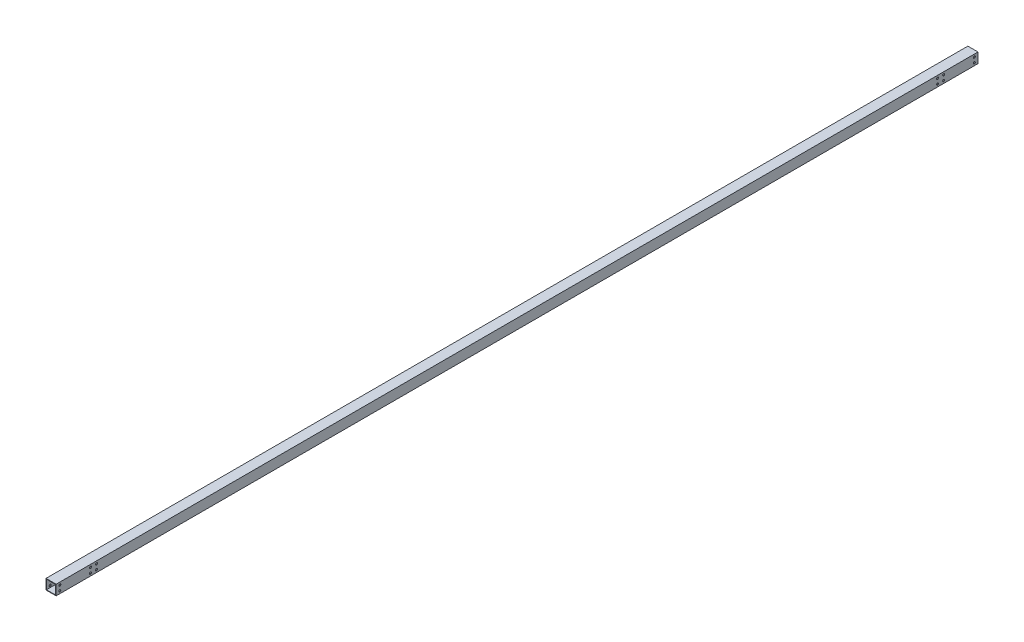
from build123d import *

# Parameters (mm, degrees)
SKETCH_1_W          = 20
SKETCH_1_H          = 20
SKETCH_1_W_2        = 18
SKETCH_1_H_2        = 18
EXTRUDE_1_DEPTH     = 1820
SKETCH_2_R          = 2
CUT_EXTRUDE_1_DEPTH = 1821.219766951


with BuildPart() as part:
    # 草图1 → 凸台-拉伸1 (new body)
    with BuildSketch(Plane.XY):
        with Locations((10, 10)):
            Rectangle(SKETCH_1_W, SKETCH_1_H)
        with Locations((10, 10)):
            Rectangle(SKETCH_1_W_2, SKETCH_1_H_2, mode=Mode.SUBTRACT)
    extrude(amount=EXTRUDE_1_DEPTH)

    # 草图2 → 切除-拉伸1 (cut, through all)
    with BuildSketch(Plane.ZY):
        with Locations((1812.8, 5)):
            Circle(SKETCH_2_R)
        with Locations((1812.8, 15)):
            Circle(SKETCH_2_R)
        with Locations((1752.2, 15)):
            Circle(SKETCH_2_R)
        with Locations((1740.2, 15)):
            Circle(SKETCH_2_R)
        with Locations((1740.2, 5)):
            Circle(SKETCH_2_R)
        with Locations((1752.2, 5)):
            Circle(SKETCH_2_R)
        with Locations((7.2, 5)):
            Circle(SKETCH_2_R)
        with Locations((7.2, 15)):
            Circle(SKETCH_2_R)
        with Locations((67.8, 15)):
            Circle(SKETCH_2_R)
        with Locations((79.8, 15)):
            Circle(SKETCH_2_R)
        with Locations((79.8, 5)):
            Circle(SKETCH_2_R)
        with Locations((67.8, 5)):
            Circle(SKETCH_2_R)
    extrude(amount=-CUT_EXTRUDE_1_DEPTH, mode=Mode.SUBTRACT)


solid = part.part
